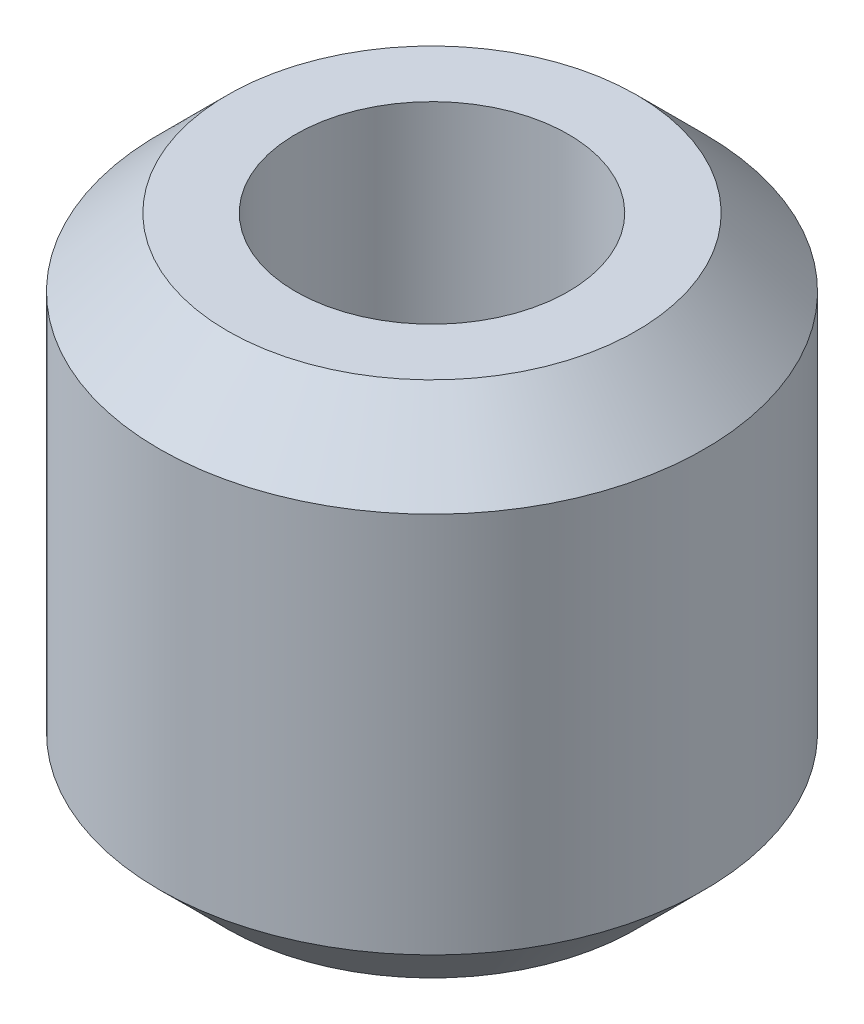
from build123d import *

# Parameters (mm, degrees)
SKETCH1_W     = 5
SKETCH1_H     = 19
CHAMFER1_SIZE = 2.5
CHAMFER2_SIZE = 2.5


with BuildPart() as part:
    # Sketch1 → Revolve1 (revolve)
    with BuildSketch(Plane.XY, mode=Mode.PRIVATE) as revolve1_sk:
        with Locations((-7.5, 2.799270073)):
            Rectangle(SKETCH1_W, SKETCH1_H)
    revolve(revolve1_sk.sketch.rotate(Axis((0, 14.390243325, 0), (0, -1, 0)), 270), axis=Axis((0, 14.390243325, 0), (0, -1, 0)))

    # Chamfer1
    chamfer1_edges = [part.edges().sort_by_distance(p)[0] for p in [
        (0, 12.299270073, -10),
    ]]
    chamfer(chamfer1_edges, length=CHAMFER1_SIZE)

    # Chamfer2
    chamfer2_edges = [part.edges().sort_by_distance(p)[0] for p in [
        (0, -6.700729927, -10),
    ]]
    chamfer(chamfer2_edges, length=CHAMFER2_SIZE)


solid = part.part
